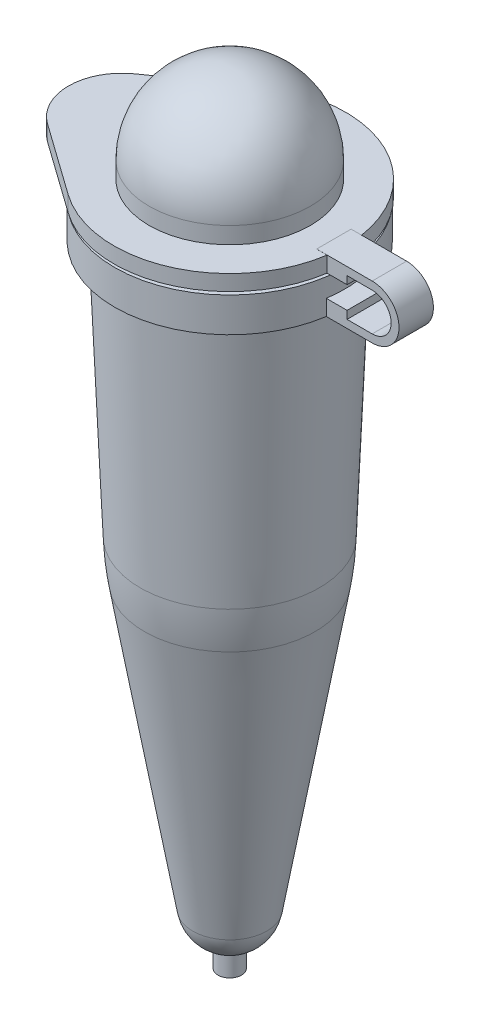
from build123d import *

# Parameters (mm, degrees)
SKETCH1_R           = 3.7338
SKETCH1_R_2         = 2.6797
BOSS_EXTRUDE1_DEPTH = 1.1176
SHELL1_T            = -0.5715
BOSS_EXTRUDE2_DEPTH = 0.5588
SKETCH4_R           = 2.615046293
SKETCH4_R_2         = 2.107046293
BOSS_EXTRUDE3_DEPTH = 1.1176
BOSS_EXTRUDE4_DEPTH = 0.508
SKETCH7_W           = 0.381
SKETCH7_H           = 0.933727322


with BuildPart() as part:
    # Sketch1 → Boss-Extrude1 (new body)
    with BuildSketch(Plane(origin=(0, 0, 0), x_dir=(1, 0, 0), z_dir=(0, 1, 0))):
        with Locations(Location((0, 0, 0), (0, 0, 270))):
            Circle(SKETCH1_R)
        with Locations(Location((0, 0, 0), (0, 0, 270))):
            Circle(SKETCH1_R_2, mode=Mode.SUBTRACT)
    extrude(amount=-BOSS_EXTRUDE1_DEPTH)


with BuildPart() as body_2:
    # Sketch2 → Revolve1 (revolve)
    with BuildSketch(Plane.XY):
        with BuildLine():
            Line((0, -1.1176), (0, -20.9296))
            ThreePointArc((0, -20.9296), (-0.789505828, -20.640890822), (-1.206518449, -19.910977871))
            Line((-1.206518449, -19.910977871), (-2.770770199, -10.714786652))
            ThreePointArc((-2.770770199, -10.714786652), (-2.859495986, -10.068144543), (-2.906518408, -9.4171398))
            Line((-2.906518408, -9.4171398), (-3.2385, -1.1176))
            Line((-3.2385, -1.1176), (0, -1.1176))
        make_face()
    revolve(axis=Axis((0, -1.1176, 0), (0, -1, 0)))

    # Shell1
    shell1_openings = [body_2.faces().sort_by_distance(p)[0] for p in [
        (0, -1.1176, 0),
    ]]
    offset(amount=SHELL1_T, openings=shell1_openings, kind=Kind.INTERSECTION)


with BuildPart() as part_1:
    add(part.part)

    # Combine1: union body 2
    add(body_2.part)

    # Sketch3 → Boss-Extrude2 (add, symmetric)
    with BuildSketch(Plane.XY):
        with BuildLine():
            Line((3.7338, -1.1176), (4.365322861, -1.1176))
            Line((4.365322861, -1.1176), (5.180035681, -1.1176))
            ThreePointArc((5.180035681, -1.1176), (6.050241958, -0.247393722), (5.180035681, 0.622812555))
            Line((5.180035681, 0.622812555), (4.365322861, 0.622812555))
            Line((4.365322861, 0.622812555), (3.379294532, 0.622812555))
            Line((3.379294532, 0.622812555), (3.379294532, 0.112660745))
            Line((3.379294532, 0.112660745), (4.365322861, 0.112660745))
            Line((4.365322861, 0.112660745), (4.365322861, 0.36773665))
            Line((4.365322861, 0.36773665), (5.180035681, 0.36773665))
            ThreePointArc((5.180035681, 0.36773665), (5.795166053, -0.247393722), (5.180035681, -0.862524095))
            Line((5.180035681, -0.862524095), (4.365322861, -0.862524095))
            Line((4.365322861, -0.862524095), (4.365322861, -0.607448189))
            Line((4.365322861, -0.607448189), (3.379294532, -0.607448189))
            Line((3.379294532, -0.607448189), (3.379294532, -1.1176))
            Line((3.379294532, -1.1176), (3.7338, -1.1176))
        make_face()
    extrude(amount=BOSS_EXTRUDE2_DEPTH, both=True)



with BuildPart() as body_2_2:
    # Sketch4 → Boss-Extrude3 (new body)
    with BuildSketch(Plane.XZ.offset(-0.112660745)):
        with Locations(Location((0, 0, 0), (0, 0, 270))):
            Circle(SKETCH4_R)
        with Locations(Location((0, 0, 0), (0, 0, 270))):
            Circle(SKETCH4_R_2, mode=Mode.SUBTRACT)
    extrude(amount=BOSS_EXTRUDE3_DEPTH)

    # Sketch5 → Revolve2 (revolve)
    with BuildSketch(Plane.XY):
        with BuildLine():
            Line((-2.615046293, 0.112660745), (-2.615046293, 1.160799378))
            ThreePointArc((-2.615046293, 1.160799378), (-1.849116967, 3.009916345), (0, 3.775845671))
            Line((0, 3.775845671), (0, 3.267845671))
            ThreePointArc((0, 3.267845671), (-1.489906722, 2.6507061), (-2.107046293, 1.160799378))
            Line((-2.107046293, 1.160799378), (-2.107046293, 0.112660745))
            Line((-2.107046293, 0.112660745), (-2.107046293, 0.047504608))
            Line((-2.107046293, 0.047504608), (-2.615046293, 0.047504608))
            Line((-2.615046293, 0.047504608), (-2.615046293, 0.112660745))
        make_face()
    revolve(axis=Axis((0, 3.775845671, 0), (0, -1, 0)))


with BuildPart() as part_2:
    add(part_1.part)

    add(body_2_2.part)  # Boss-Extrude4 merges body 2 2
    # Sketch6 → Boss-Extrude4 (add)
    with BuildSketch(Plane.XZ.offset(-0.112660745)):
        with BuildLine():
            Line((-2.179935272, -3.062591525), (-4.50743423, -1.405890971))
            ThreePointArc((-4.50743423, -1.405890971), (-5.2324, 0), (-4.50743423, 1.405890971))
            Line((-4.50743423, 1.405890971), (-2.179935272, 3.062591525))
            ThreePointArc((-2.179935272, 3.062591525), (3.7592, 0), (-2.179935272, -3.062591525))
        make_face()
    extrude(amount=-BOSS_EXTRUDE4_DEPTH)

    # Sketch7 → Revolve3 (revolve)
    with BuildSketch(Plane.XY, mode=Mode.PRIVATE) as revolve3_sk:
        with Locations((-0.1905, -21.097736339)):
            Rectangle(SKETCH7_W, SKETCH7_H)
    revolve(revolve3_sk.sketch.rotate(Axis((0, -20.630872678, 0), (0, -1, 0)), 270), axis=Axis((0, -20.630872678, 0), (0, -1, 0)))


solid = part_2.part
